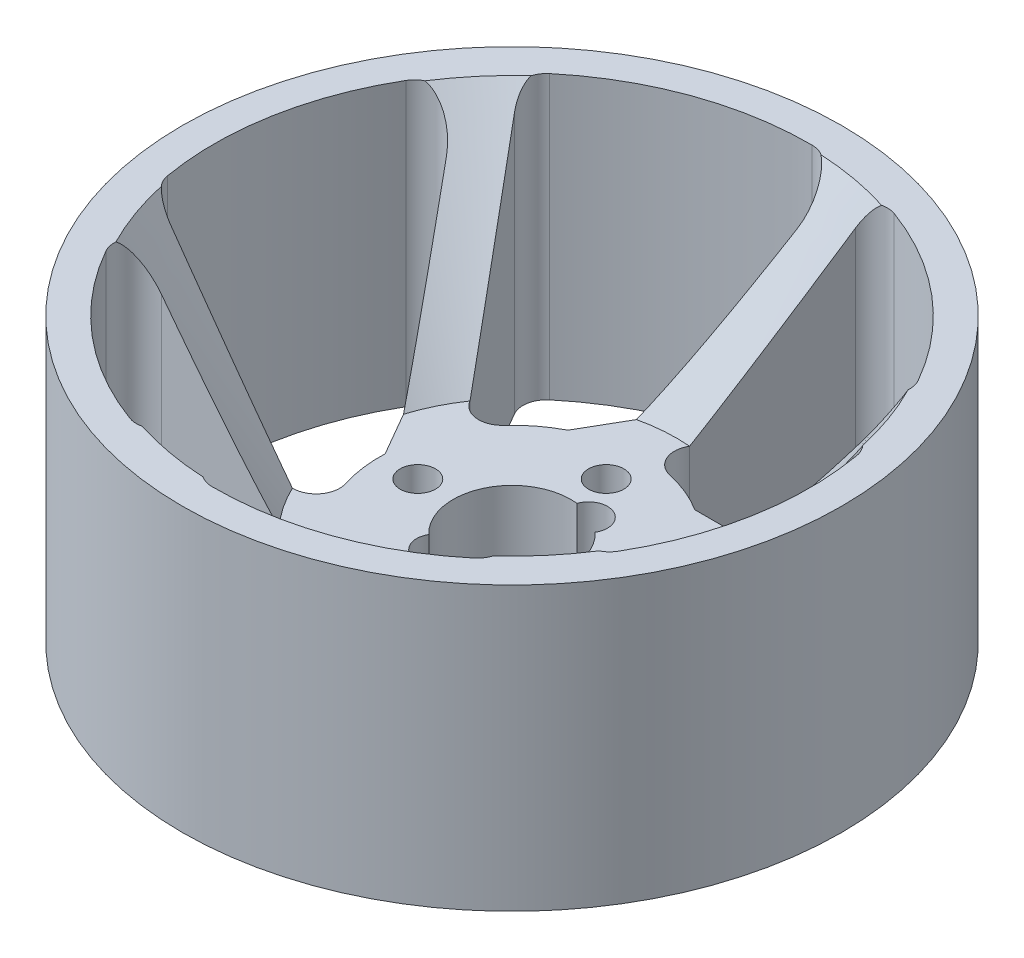
from build123d import *

# Parameters (mm, degrees)
SKETCH1_R           = 28
BOSS_EXTRUDE1_DEPTH = 24
SKETCH6_R           = 1.9
CUT_EXTRUDE6_DEPTH  = 24
CUT_EXTRUDE7_DEPTH  = 24
CIRPATTERN1_COUNT   = 6
SKETCH17_R          = 1.5
CUT_EXTRUDE9_DEPTH  = 8
SKETCH18_R          = 1.607527434
CUT_EXTRUDE10_DEPTH = 8


with BuildPart() as part:
    # Sketch1 → Boss-Extrude1 (new body)
    with BuildSketch(Plane(origin=(0, 0, 0), x_dir=(1, 0, 0), z_dir=(0, 1, 0))):
        with Locations(Location((0, 0, 0), (0, 0, 270))):
            Circle(SKETCH1_R)
    extrude(amount=BOSS_EXTRUDE1_DEPTH)

    # Sketch6 → Cut-Extrude6 (cut)
    with BuildSketch(Plane(origin=(0, 0, 0), x_dir=(1, 0, 0), z_dir=(0, 1, 0))):
        with Locations(Location((0, 0, 0), (0, 0, 270))):
            Circle(SKETCH6_R)
    extrude(amount=CUT_EXTRUDE6_DEPTH, mode=Mode.SUBTRACT)

    # Sketch3 → Cut-Extrude7 (cut)
    with BuildSketch(Plane(origin=(0, 0, 0), x_dir=(1, 0, 0), z_dir=(0, 1, 0))):
        with BuildLine():
            Line((6.025985397, 9.5), (20.264254242, 9.5))
            ThreePointArc((20.264254242, 9.5), (21.992584206, 10.493582822), (22.003675207, 12.487124464))
            ThreePointArc((22.003675207, 12.487124464), (16.353652552, 19.304094079), (8.700746754, 23.756830721))
            ThreePointArc((8.700746754, 23.756830721), (7.330784322, 23.758890252), (6.280889879, 22.878820388))
            Line((6.280889879, 22.878820388), (1.119750126, 13.939464109))
            ThreePointArc((1.119750126, 13.939464109), (1.021677147, 12.132837227), (2.421340415, 10.986337451))
            ThreePointArc((2.421340415, 10.986337451), (4.288546152, 10.400522675), (6.025985397, 9.5))
        make_face()
    cut_extrude7 = extrude(amount=CUT_EXTRUDE7_DEPTH, mode=Mode.SUBTRACT)

    # CirPattern1: Cut-Extrude7 ×6 about axis
    cirpattern1_axis = Axis((0, 0, 0), (0, 1, 0))
    for i in range(1, CIRPATTERN1_COUNT):
        add(cut_extrude7.rotate(cirpattern1_axis, i * 360 / CIRPATTERN1_COUNT), mode=Mode.SUBTRACT)

    # Sketch14 → Revolve1 (revolve)
    with BuildSketch(Plane.XY):
        Polygon((25.5, 13), (25.5, 12), (28, 12), (28, 14), align=None)
    revolve1 = revolve(axis=Axis((0, 24, 0), (0, -1, 0)))

    # Mirror11: Revolve1 across plane
    add(revolve1.mirror(Plane.ZX.offset(12)))

    # Sketch15 → Cut-Revolve5 (revolve, cut)
    with BuildSketch(Plane.XY, mode=Mode.PRIVATE) as cut_revolve5_sk:
        Polygon((5, 8), (5, 0), (0, 0), (0, 8), (0, 24), (25, 24), (14, 8), align=None)
    revolve(cut_revolve5_sk.sketch.rotate(Axis((0, 8, 0), (0, -1, 0)), 90), axis=Axis((0, 8, 0), (0, -1, 0)), mode=Mode.SUBTRACT)

    # Sketch17 → Cut-Extrude9 (cut)
    with BuildSketch(Plane(origin=(0, 0, 0), x_dir=(1, 0, 0), z_dir=(0, 1, 0))):
        with Locations(Location((0, 8, 0), (0, 0, 270))):
            Circle(SKETCH17_R)
        with Locations(Location((8, 0, 0), (0, 0, 270))):
            Circle(SKETCH17_R)
        with Locations(Location((0, -8, 0), (0, 0, 270))):
            Circle(SKETCH17_R)
        with Locations(Location((-8, 0, 0), (0, 0, 270))):
            Circle(SKETCH17_R)
    extrude(amount=CUT_EXTRUDE9_DEPTH, mode=Mode.SUBTRACT)

    # Sketch18 → Cut-Extrude10 (cut)
    with BuildSketch(Plane(origin=(0, 0, 0), x_dir=(1, 0, 0), z_dir=(0, 1, 0))):
        with Locations((2.064206095, 4.435689462)):
            Circle(SKETCH18_R)
        with Locations((-2.064206095, -4.435689462)):
            Circle(SKETCH18_R)
    extrude(amount=CUT_EXTRUDE10_DEPTH, mode=Mode.SUBTRACT)


solid = part.part
